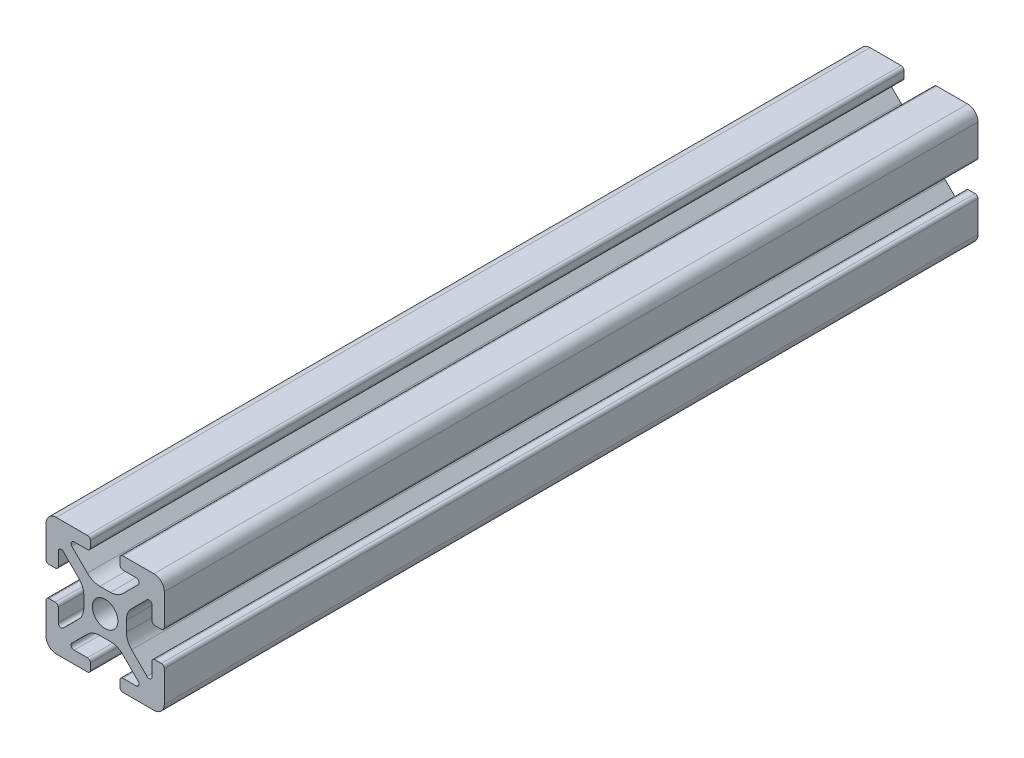
from build123d import *

# Parameters (mm, degrees)
BOSS_EXTRUDE1_DEPTH = 70
SKETCH5_W           = 27.787302718
SKETCH5_H           = 26.03929452
CUT_EXTRUDE1_DEPTH  = 2.4


with BuildPart() as part:
    # Sketch4 → Boss-Extrude1 (new, symmetric)
    with BuildSketch(Plane.XY):
        with BuildLine():
            Line((3, -10), (8.25, -10))
            ThreePointArc((8.25, -10), (9.487436867, -9.487436867), (10, -8.25))
            Line((10, -8.25), (10, -3))
            ThreePointArc((10, -3), (9.853553391, -2.646446609), (9.5, -2.5))
            Line((9.5, -2.5), (8.424621202, -2.5))
            ThreePointArc((8.424621202, -2.5), (8.071067812, -2.646446609), (7.924621202, -3))
            Line((7.924621202, -3), (7.924621202, -5.25))
            ThreePointArc((7.924621202, -5.25), (7.615962919, -5.711939766), (7.071067812, -5.603553391))
            Line((7.071067812, -5.603553391), (4.478679656, -3.011165235))
            ThreePointArc((4.478679656, -3.011165235), (3.828361402, -2.037895189), (3.6, -0.889844892))
            Line((3.6, -0.889844892), (3.6, 0))
            Line((3.6, 0), (2.15, 0))
            ThreePointArc((2.15, 0), (1.52027958, -1.52027958), (0, -2.15))
            Line((0, -2.15), (0, -3.6))
            Line((0, -3.6), (0.889844892, -3.6))
            ThreePointArc((0.889844892, -3.6), (2.037895189, -3.828361402), (3.011165235, -4.478679656))
            Line((3.011165235, -4.478679656), (5.603553391, -7.071067812))
            ThreePointArc((5.603553391, -7.071067812), (5.711939766, -7.615962919), (5.25, -7.924621202))
            Line((5.25, -7.924621202), (3, -7.924621202))
            ThreePointArc((3, -7.924621202), (2.646446609, -8.071067812), (2.5, -8.424621202))
            Line((2.5, -8.424621202), (2.5, -9.5))
            ThreePointArc((2.5, -9.5), (2.646446609, -9.853553391), (3, -10))
        make_face()
    extrude(amount=BOSS_EXTRUDE1_DEPTH, both=True)

    # Mirror1: part across plane


with BuildPart() as part_1:
    add(part.part)
    add(part.part.mirror(Plane(origin=(0, 0, 0), x_dir=(0, 0, 1), z_dir=(1, 0, 0))))

    # Mirror2: part across plane


with BuildPart() as part_2:
    add(part_1.part)
    add(part_1.part.mirror(Plane.ZX))

    # Sketch5 → Cut-Extrude1 (cut)
    with BuildSketch(Plane.XY.offset(70)):
        with Locations((-0.060276145, -0.663037592)):
            Rectangle(SKETCH5_W, SKETCH5_H)
    extrude(amount=-CUT_EXTRUDE1_DEPTH, mode=Mode.SUBTRACT)


solid = part_2.part
